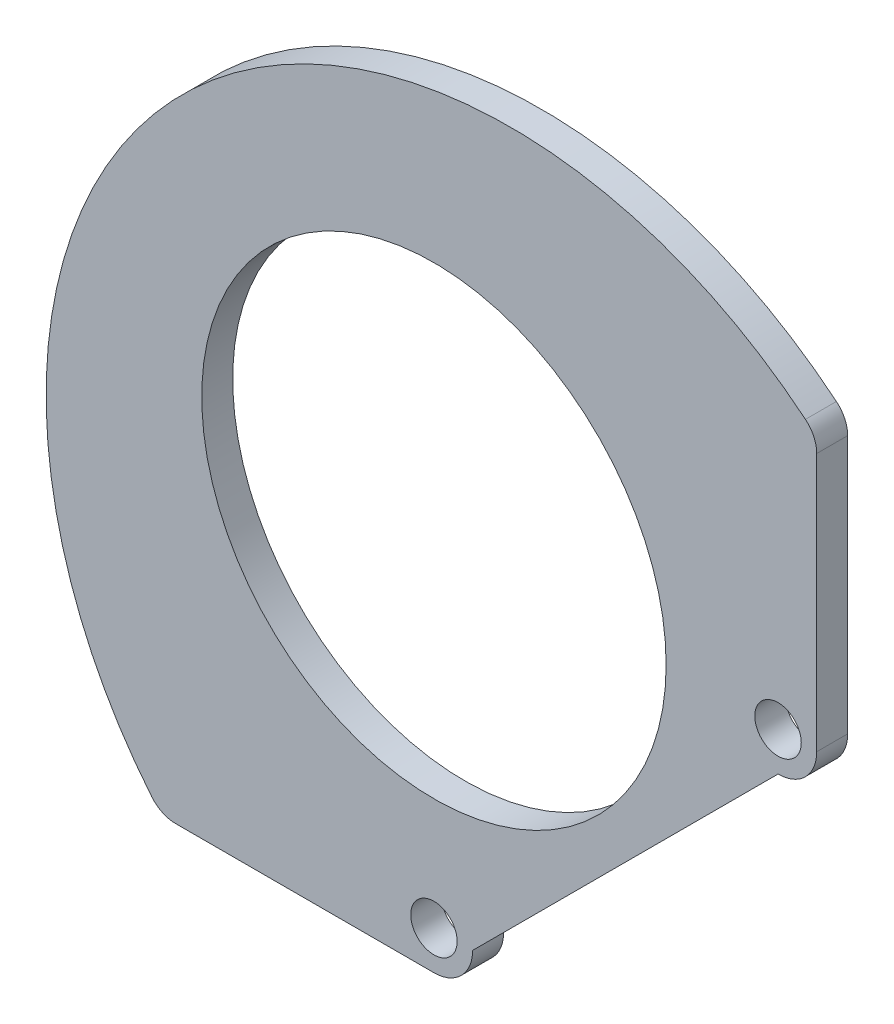
from build123d import *

# Parameters (mm, degrees)
SKETCH1_R           = 15
SKETCH1_R_2         = 1.5
BOSS_EXTRUDE1_DEPTH = 2
FILLET1_R           = 2


with BuildPart() as part:
    # Sketch1 → Boss-Extrude1 (new body)
    with BuildSketch(Plane.XY):
        with BuildLine():
            Line((-22.557559524, -19.777677021), (-4.949747468, -19.777677021))
            ThreePointArc((-4.949747468, -19.777677021), (-3.181980515, -19.045443974), (-2.449747468, -17.277677021))
            Line((-2.449747468, -17.277677021), (17.277677021, 2.449747468))
            ThreePointArc((17.277677021, 2.449747468), (19.045443974, 3.181980515), (19.777677021, 4.949747468))
            Line((19.777677021, 4.949747468), (19.777677021, 22.557559524))
            ThreePointArc((19.777677021, 22.557559524), (-21.213203436, 21.213203436), (-22.557559524, -19.777677021))
        make_face()
        with Locations((-4.949747468, 4.949747468)):
            Circle(SKETCH1_R, mode=Mode.SUBTRACT)
        with Locations((-4.949747468, -17.277677021)):
            Circle(SKETCH1_R_2, mode=Mode.SUBTRACT)
        with Locations((17.277677021, 4.949747468)):
            Circle(SKETCH1_R_2, mode=Mode.SUBTRACT)
    extrude(amount=BOSS_EXTRUDE1_DEPTH)

    # Fillet1
    fillet1_edges = [part.edges().sort_by_distance(p)[0] for p in [
        (-22.557559524, -19.777677021, 1),
        (19.777677021, 22.557559524, 1),
    ]]
    fillet(fillet1_edges, radius=FILLET1_R)


solid = part.part
